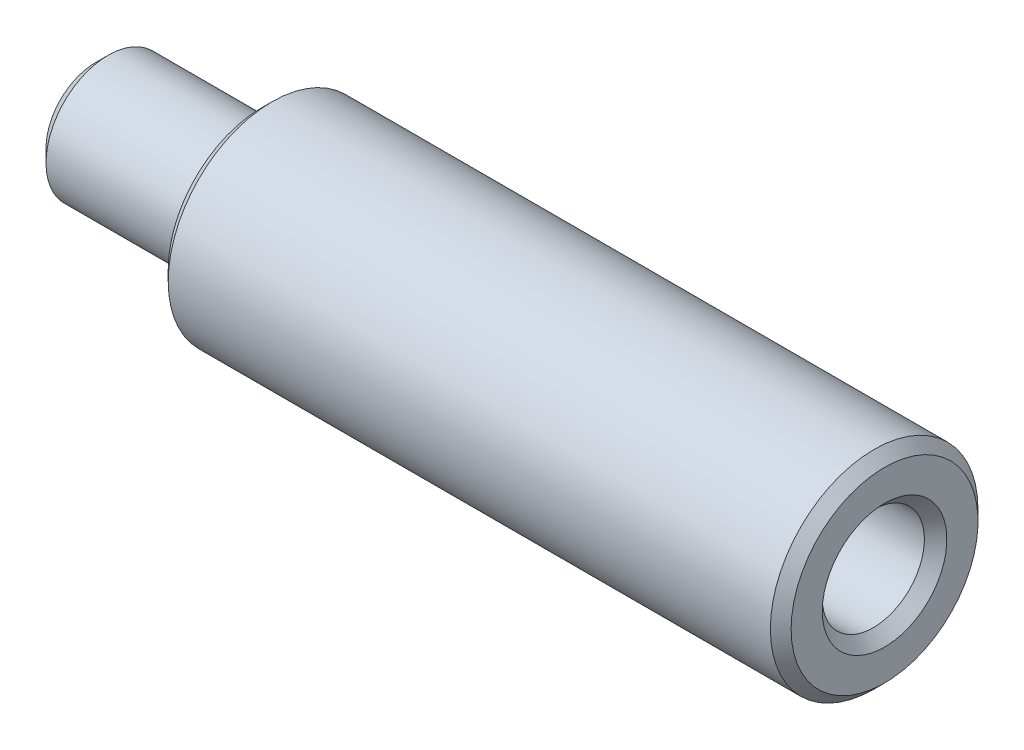
from build123d import *


with BuildPart() as part:
    # Sketch1 → Revolve1 (revolve)
    with BuildSketch(Plane.XY, mode=Mode.PRIVATE) as revolve1_sk:
        Polygon((0, 0), (0, 4.5), (0.5, 5), (29.5, 5), (30, 4.5), (30, 0), align=None)
    revolve(revolve1_sk.sketch.rotate(Axis((30, 0, 0), (-1, 0, 0)), 270), axis=Axis((30, 0, 0), (-1, 0, 0)))

    # Sketch2 → Revolve2 (revolve)
    with BuildSketch(Plane.XY, mode=Mode.PRIVATE) as revolve2_sk:
        with BuildLine():
            Line((-8, 0), (-8, 2.3865))
            Line((-8, 2.3865), (-7.3865, 3))
            Line((-7.3865, 3), (-0.5, 3))
            ThreePointArc((-0.5, 3), (-0.146446609, 3.146446609), (0, 3.5))
            Line((0, 3.5), (0, 0))
            Line((0, 0), (-8, 0))
        make_face()
    revolve(revolve2_sk.sketch.rotate(Axis((0, 0, 0), (-1, 0, 0)), 270), axis=Axis((0, 0, 0), (-1, 0, 0)))

    # Sketch3 → Cut-Revolve1 (revolve, cut)
    with BuildSketch(Plane.XY, mode=Mode.PRIVATE) as cut_revolve1_sk:
        Polygon((5, 0), (6.419415637, 2.4585), (29.4585, 2.4585), (30, 3), (30, 0), align=None)
    revolve(cut_revolve1_sk.sketch.rotate(Axis((30, 0, 0), (-1, 0, 0)), 270), axis=Axis((30, 0, 0), (-1, 0, 0)), mode=Mode.SUBTRACT)


solid = part.part
